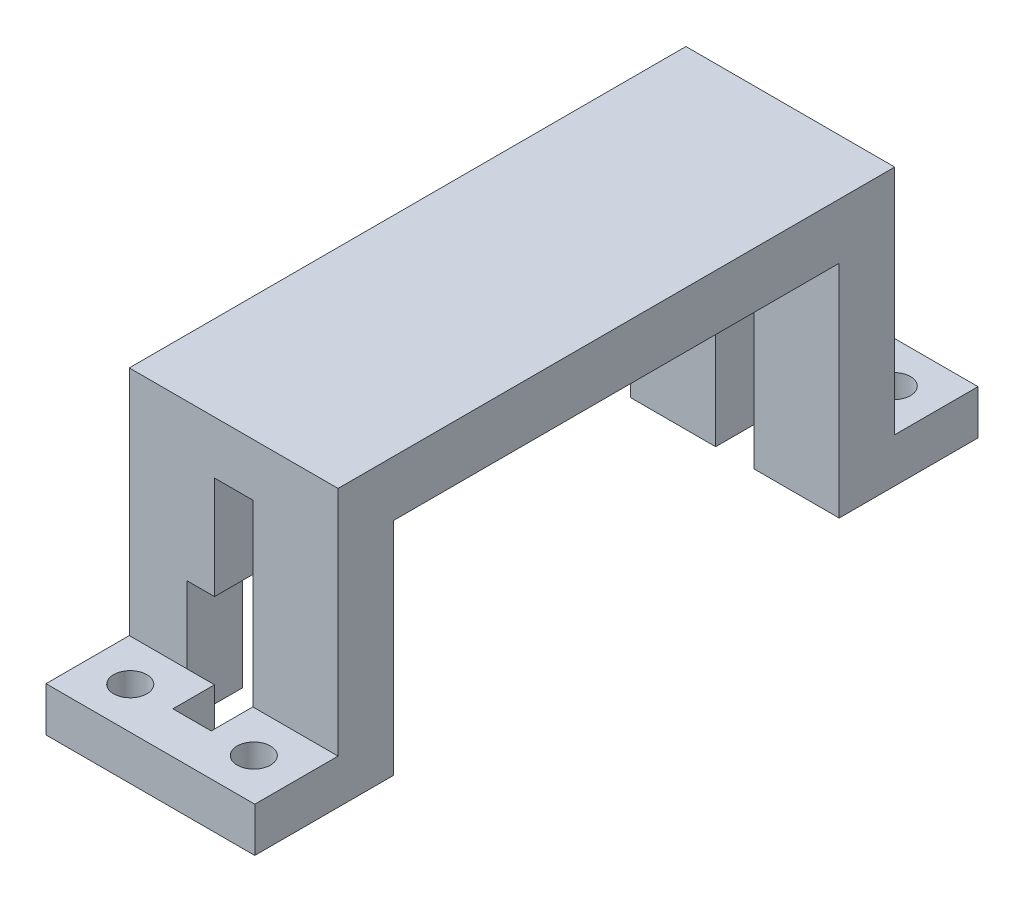
from build123d import *

# Parameters (mm, degrees)
BOSS_EXTRUDE1_DEPTH = 18.8
SKETCH2_W           = 3.45
SKETCH2_H           = 20.125
CUT_EXTRUDE1_DEPTH  = 73.204371405
CUT_EXTRUDE2_REACH  = 45.006
SKETCH3_R           = 1.5
BOSS_EXTRUDE2_REACH = 44.46
SKETCH7_W           = 3.75
SKETCH7_H           = 4
CUT_EXTRUDE8_DEPTH  = 2.5


with BuildPart() as part:
    # Sketch1 → Boss-Extrude1 (new body)
    with BuildSketch(Plane(origin=(0, 0, 0), x_dir=(0, 0, -1), z_dir=(1, 0, 0))):
        Polygon((-25.0625, 0), (25.0625, 0), (25.0625, -20.875), (32.5625, -20.875), (32.5625, -24.875), (25.0625, -24.875), (20.0625, -24.875), (20.0625, -5), (-20.0625, -5), (-20.0625, -24.875), (-25.0625, -24.875), (-32.5625, -24.875), (-32.5625, -20.875), (-25.0625, -20.875), align=None)
    extrude(amount=BOSS_EXTRUDE1_DEPTH)

    # Sketch2 → Cut-Extrude1 (cut, through all)
    with BuildSketch(Plane.XY.offset(32.5625)):
        with Locations((9.4, -14.8125)):
            Rectangle(SKETCH2_W, SKETCH2_H)
    extrude(amount=-CUT_EXTRUDE1_DEPTH, mode=Mode.SUBTRACT)

    # Sketch3 → Cut-Extrude2 (cut, up to next)
    with BuildSketch(Plane(origin=(0, -20.875, 0), x_dir=(1, 0, 0), z_dir=(0, 1, 0)), mode=Mode.PRIVATE) as cut_extrude2_sk1:
        with Locations(Location((3.8375, -28.8125, 0), (0, 0, 270))):
            Circle(SKETCH3_R)
    cut_extrude2_tool1 = extrude(cut_extrude2_sk1.sketch, amount=-CUT_EXTRUDE2_REACH, mode=Mode.PRIVATE) & part.part
    # Sketch3 → Cut-Extrude2 (cut, up to next)
    with BuildSketch(Plane(origin=(0, -20.875, 0), x_dir=(1, 0, 0), z_dir=(0, 1, 0)), mode=Mode.PRIVATE) as cut_extrude2_sk2:
        with Locations(Location((14.9625, -28.8125, 0), (0, 0, 270))):
            Circle(SKETCH3_R)
    cut_extrude2_tool2 = extrude(cut_extrude2_sk2.sketch, amount=-CUT_EXTRUDE2_REACH, mode=Mode.PRIVATE) & part.part
    # Sketch3 → Cut-Extrude2 (cut, up to next)
    with BuildSketch(Plane(origin=(0, -20.875, 0), x_dir=(1, 0, 0), z_dir=(0, 1, 0)), mode=Mode.PRIVATE) as cut_extrude2_sk3:
        with Locations(Location((14.9625, 28.8125, 0), (0, 0, 270))):
            Circle(SKETCH3_R)
    cut_extrude2_tool3 = extrude(cut_extrude2_sk3.sketch, amount=-CUT_EXTRUDE2_REACH, mode=Mode.PRIVATE) & part.part
    # Sketch3 → Cut-Extrude2 (cut, up to next)
    with BuildSketch(Plane(origin=(0, -20.875, 0), x_dir=(1, 0, 0), z_dir=(0, 1, 0)), mode=Mode.PRIVATE) as cut_extrude2_sk4:
        with Locations(Location((3.8375, 28.8125, 0), (0, 0, 270))):
            Circle(SKETCH3_R)
    cut_extrude2_tool4 = extrude(cut_extrude2_sk4.sketch, amount=-CUT_EXTRUDE2_REACH, mode=Mode.PRIVATE) & part.part
    add(cut_extrude2_tool1.solids().sort_by_distance((3.8375, -20.875, 28.8125))[0], mode=Mode.SUBTRACT)
    add(cut_extrude2_tool2.solids().sort_by_distance((14.9625, -20.875, 28.8125))[0], mode=Mode.SUBTRACT)
    add(cut_extrude2_tool3.solids().sort_by_distance((14.9625, -20.875, -28.8125))[0], mode=Mode.SUBTRACT)
    add(cut_extrude2_tool4.solids().sort_by_distance((3.8375, -20.875, -28.8125))[0], mode=Mode.SUBTRACT)

    # Sketch7 → Boss-Extrude2 (add, up to next)
    with BuildSketch(Plane(origin=(7.675, 0, 0), x_dir=(0, 0, -1), z_dir=(1, 0, 0)), mode=Mode.PRIVATE) as boss_extrude2_sk1:
        with Locations((-30.6875, -22.875)):
            Rectangle(SKETCH7_W, SKETCH7_H)
    boss_extrude2_tool1 = extrude(boss_extrude2_sk1.sketch, amount=BOSS_EXTRUDE2_REACH, mode=Mode.PRIVATE) - part.part
    boss_extrude2 = boss_extrude2_tool1.solids().sort_by_distance((7.675, -22.875, 30.6875))[0]
    add(boss_extrude2)

    # Mirror1: Boss-Extrude2 across plane
    add(boss_extrude2.mirror(Plane.XY))

    # Sketch4 → Cut-Extrude8 (cut)
    with BuildSketch(Plane(origin=(7.675, 0, 0), x_dir=(0, 0, -1), z_dir=(1, 0, 0))):
        Polygon((-20.0625, -24.875), (-20.0625, -15.75), (-20.0625, -14), (-25.0625, -14), (-25.0625, -15.75), (-25.0625, -24.875), align=None)
    extrude(amount=-CUT_EXTRUDE8_DEPTH, mode=Mode.SUBTRACT)


solid = part.part
